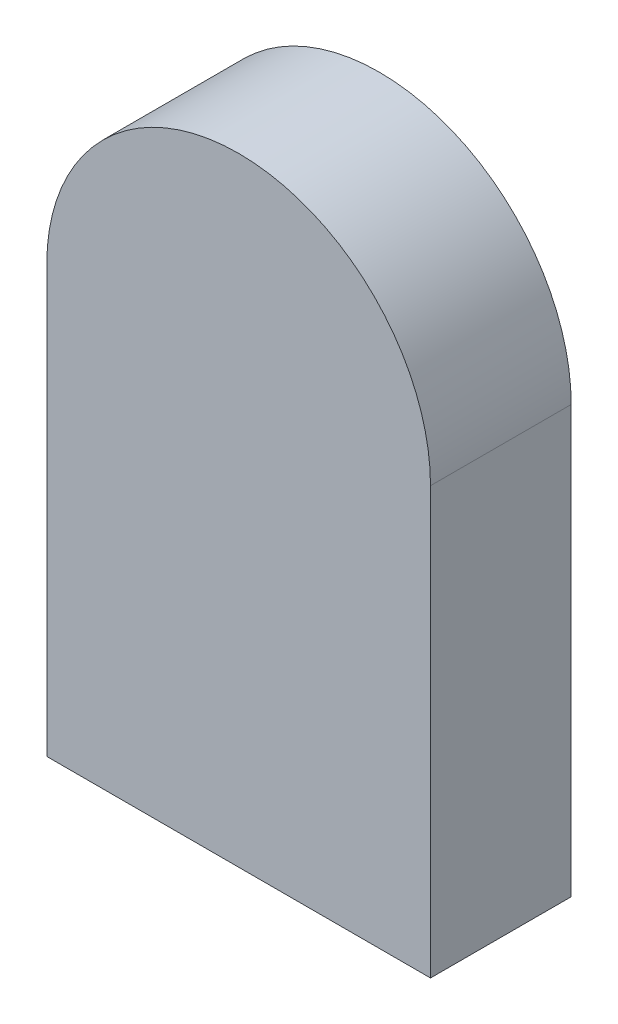
from build123d import *

# Parameters (mm, degrees)
BOSS_EXTRUDE1_DEPTH = 8.382


with BuildPart() as part:
    # Sketch1 → Boss-Extrude1 (new body)
    with BuildSketch(Plane.XY):
        with BuildLine():
            Line((-11.43, -25.4), (11.43, -25.4))
            Line((11.43, -25.4), (11.43, 0))
            ThreePointArc((11.43, 0), (0, 11.43), (-11.43, 0))
            Line((-11.43, 0), (-11.43, -25.4))
        make_face()
    extrude(amount=BOSS_EXTRUDE1_DEPTH)


solid = part.part
